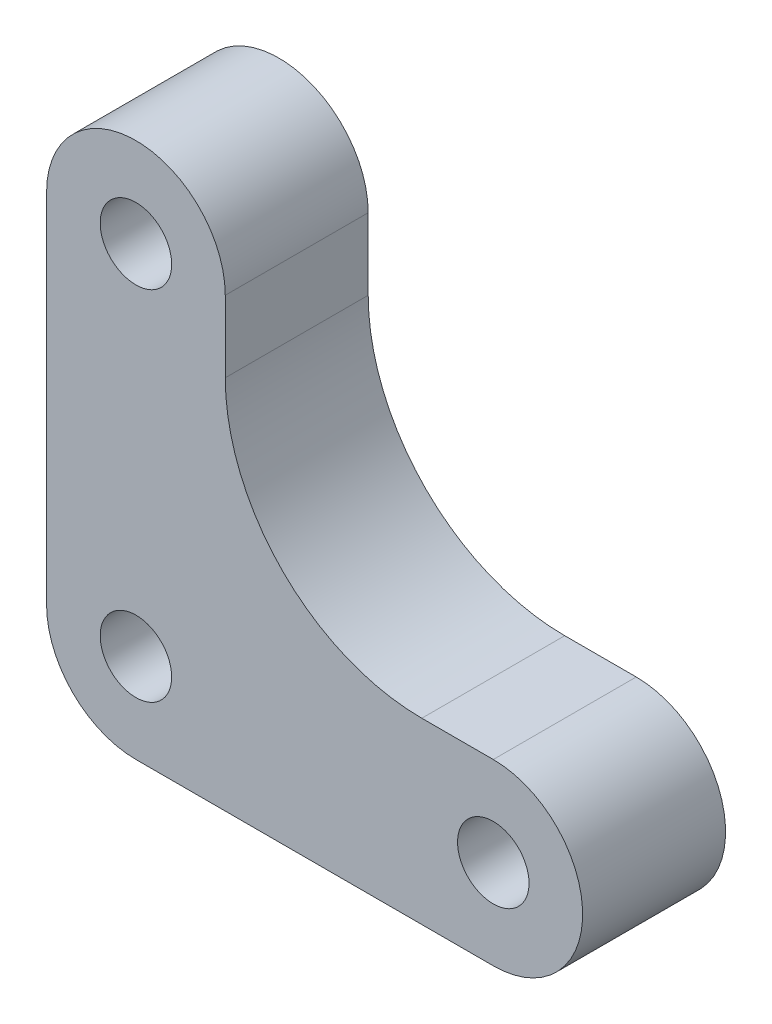
from build123d import *

# Parameters (mm, degrees)
BOSS_EXTRUDE1_DEPTH          = 8
CUT_EXTRUDE1_DEPTH           = 3
F_4_0_4_DIAMETER_HOLE1_D     = 4
F_4_0_4_DIAMETER_HOLE1_DEPTH = 8
FILLET1_R                    = 3
FILLET2_R                    = 5
FILLET3_R                    = 11
FILLET4_R                    = 13


with BuildPart() as part:
    # Sketch1 → Boss-Extrude1 (new body)
    with BuildSketch(Plane(origin=(0, 0, -13), x_dir=(-1, 0, 0), z_dir=(0, 0, -1))):
        with BuildLine():
            Line((15, 20), (15, 5))
            Line((15, 5), (0, 5))
            ThreePointArc((0, 5), (-5, 0), (0, -5))
            Line((0, -5), (25, -5))
            Line((25, -5), (25, 20))
            ThreePointArc((25, 20), (20, 25), (15, 20))
        make_face()
    extrude(amount=-BOSS_EXTRUDE1_DEPTH)

    # Sketch2 → Cut-Extrude1 (cut)
    with BuildSketch(Plane(origin=(0, 0, -13), x_dir=(-1, 0, 0), z_dir=(0, 0, -1))):
        with BuildLine():
            Line((0, -3), (23, -3))
            Line((23, -3), (23, 20))
            ThreePointArc((23, 20), (20, 23), (17, 20))
            Line((17, 20), (17, 3))
            Line((17, 3), (0, 3))
            ThreePointArc((0, 3), (-3, 0), (0, -3))
        make_face()
    extrude(amount=-CUT_EXTRUDE1_DEPTH, mode=Mode.SUBTRACT)

    # Ø4.0 (4) Diameter Hole1
    with Locations(Plane.XY.offset(-5)):
        with Locations((-20, 0), (-20, 20), (0, 0)):
            Hole(F_4_0_4_DIAMETER_HOLE1_D / 2, depth=F_4_0_4_DIAMETER_HOLE1_DEPTH)

    # Fillet1
    fillet1_edges = [part.edges().sort_by_distance(p)[0] for p in [
        (-23, -3, -11.5),
    ]]
    fillet(fillet1_edges, radius=FILLET1_R)

    # Fillet2
    fillet2_edges = [part.edges().sort_by_distance(p)[0] for p in [
        (-25, -5, -9),
    ]]
    fillet(fillet2_edges, radius=FILLET2_R)

    # Fillet3
    fillet3_edges = [part.edges().sort_by_distance(p)[0] for p in [
        (-15, 5, -9),
    ]]
    fillet(fillet3_edges, radius=FILLET3_R)

    # Fillet4
    fillet4_edges = [part.edges().sort_by_distance(p)[0] for p in [
        (-17, 3, -11.5),
    ]]
    fillet(fillet4_edges, radius=FILLET4_R)


solid = part.part
